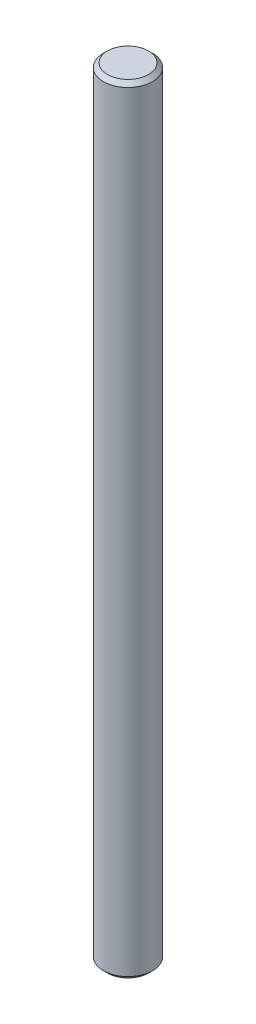
from build123d import *

# Parameters (mm, degrees)
SKETCH1_R           = 3
BOSS_EXTRUDE1_DEPTH = 95
CHAMFER1_SIZE       = 0.5


with BuildPart() as part:
    # Sketch1 → Boss-Extrude1 (new body)
    with BuildSketch(Plane(origin=(0, 0, 0), x_dir=(1, 0, 0), z_dir=(0, 1, 0))):
        with Locations(Location((0, 0, 0), (0, 0, 270))):
            Circle(SKETCH1_R)
    extrude(amount=BOSS_EXTRUDE1_DEPTH)

    # Chamfer1
    chamfer1_edges = [part.edges().sort_by_distance(p)[0] for p in [
        (0, 0, -3),
        (0, 95, -3),
    ]]
    chamfer(chamfer1_edges, length=CHAMFER1_SIZE)


solid = part.part
